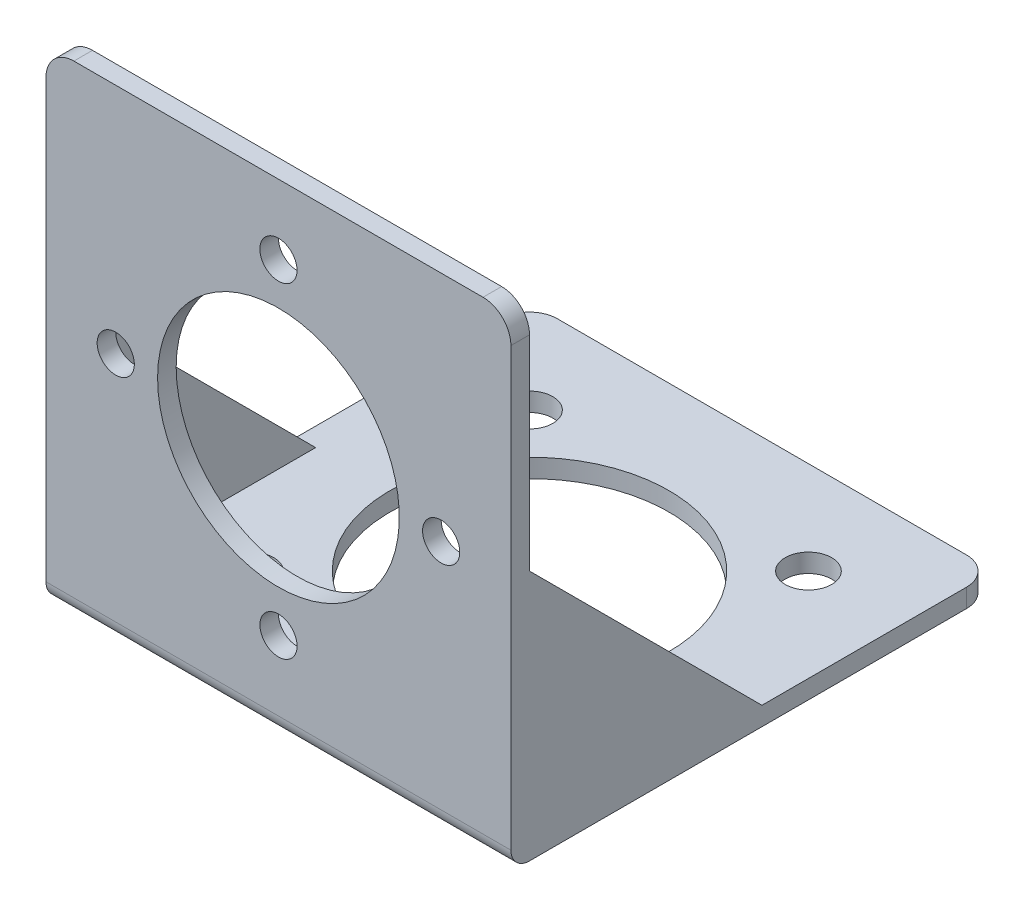
from build123d import *

# Parameters (mm, degrees)
EXTRUDE_1_DEPTH          = 50
SKETCH_2_W               = 50
SKETCH_2_H               = 50
EXTRUDE_2_DEPTH          = 2
CUT_EXTRUDE_1_DEPTH      = 46
SKETCH_4_W               = 50
SKETCH_4_H               = 52
EXTRUDE_3_DEPTH          = 2
HOLE_WIZARD_M22_1_D      = 26
HOLE_WIZARD_4_0_4_1_D    = 4
HOLE_WIZARD_M27_1_D      = 30
HOLE_WIZARD_5_0_5_1_D    = 5
FILLET_1_R               = 2
FILLET_2_R               = 3
PATTERN_CIRCULAR_1_COUNT = 4
PATTERN_CIRCULAR_2_COUNT = 4


with BuildPart() as part:
    # 草图1 → 凸台-拉伸1 (new body)
    with BuildSketch(Plane(origin=(46.138674094, 0, 0), x_dir=(0, -1, 0), z_dir=(-1, 0, 0))):
        Polygon((-27, -84.333988555), (-2, -109.333988555), (-2, -84.333988555), align=None)
    extrude(amount=-EXTRUDE_1_DEPTH)

    # 草图2 → 凸台-拉伸2 (add)
    with BuildSketch(Plane.XZ.offset(-2)):
        with Locations((71.138674094, -109.333988555)):
            Rectangle(SKETCH_2_W, SKETCH_2_H)
    extrude(amount=EXTRUDE_2_DEPTH)

    # 草图3 → 切除-拉伸1 (cut)
    with BuildSketch(Plane(origin=(48.138674094, 0, 0), x_dir=(0, -1, 0), z_dir=(-1, 0, 0))):
        Polygon((-2, -84.333988555), (-27, -84.333988555), (-2, -109.333988555), align=None)
    extrude(amount=-CUT_EXTRUDE_1_DEPTH, mode=Mode.SUBTRACT)

    # 草图4 → 凸台-拉伸3 (add)
    with BuildSketch(Plane.XY.offset(-84.333988555)):
        with Locations((71.138674094, 26)):
            Rectangle(SKETCH_4_W, SKETCH_4_H)
    extrude(amount=EXTRUDE_3_DEPTH)

    # M22 间隙孔1 (through all)
    with Locations(Plane(origin=(0, 0, -84.333988555), x_dir=(-1, 0, 0), z_dir=(0, 0, -1))):
        with Locations((-71.138674094, 27)):
            Hole(HOLE_WIZARD_M22_1_D / 2)

    # Ø4.0 (4) 直径孔1 (through all)
    with Locations(Plane(origin=(0, 0, -84.333988555), x_dir=(-1, 0, 0), z_dir=(0, 0, -1))):
        with Locations((-71.138674094, 44.5)):
            hole_wizard_4_0_4_1 = Hole(HOLE_WIZARD_4_0_4_1_D / 2)

    # M27 间隙孔1 (through all)
    with Locations(Plane(origin=(0, 2, 0), x_dir=(1, 0, 0), z_dir=(0, 1, 0))):
        with Locations((71.138674094, 109.333988555)):
            Hole(HOLE_WIZARD_M27_1_D / 2)

    # Ø5.0 (5) 直径孔1 (through all)
    with Locations(Plane(origin=(0, 2, 0), x_dir=(1, 0, 0), z_dir=(0, 1, 0))):
        with Locations((56.138674094, 124.333988555)):
            hole_wizard_5_0_5_1 = Hole(HOLE_WIZARD_5_0_5_1_D / 2)

    # 圆角1
    fillet_1_edges = [part.edges().sort_by_distance(p)[0] for p in [
        (71.138674094, 0, -82.333988555),
    ]]
    fillet(fillet_1_edges, radius=FILLET_1_R)

    # 圆角2
    fillet_2_edges = [part.edges().sort_by_distance(p)[0] for p in [
        (96.138674094, 52, -83.333988555),
        (96.138674094, 1, -134.333988555),
        (46.138674094, 52, -83.333988555),
        (46.138674094, 1, -134.333988555),
    ]]
    fillet(fillet_2_edges, radius=FILLET_2_R)

    # 阵列(圆周)1: Ø5.0 (5) 直径孔1 ×4 about axis
    pattern_circular_1_axis = Axis((71.138674094, 0, -109.333988555), (0, 1, 0))
    for i in range(1, PATTERN_CIRCULAR_1_COUNT):
        add(hole_wizard_5_0_5_1.rotate(pattern_circular_1_axis, i * 360 / PATTERN_CIRCULAR_1_COUNT), mode=Mode.SUBTRACT)

    # 阵列(圆周)2: Ø4.0 (4) 直径孔1 ×4 about axis
    pattern_circular_2_axis = Axis((71.138674094, 27, 0), (0, 0, 1))
    for i in range(1, PATTERN_CIRCULAR_2_COUNT):
        add(hole_wizard_4_0_4_1.rotate(pattern_circular_2_axis, i * 360 / PATTERN_CIRCULAR_2_COUNT), mode=Mode.SUBTRACT)


solid = part.part
